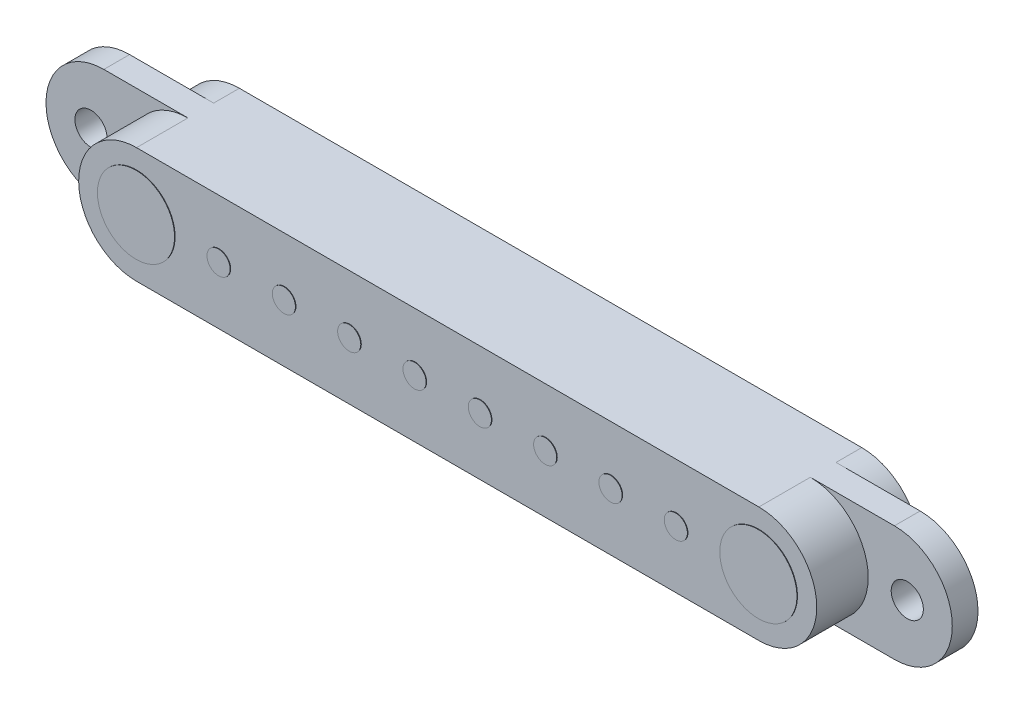
from build123d import *

# Parameters (mm, degrees)
EXTRUDE_1_DEPTH      = 4
EXTRUDE_START        = -2
SKETCH_2_3_R         = 0.625
EXTRUDE_2_DEPTH      = 1
EXTRUDE_3_DEPTH      = 1.5
EXTRUDE_3_DEPTH_BACK = 4.02
SKETCH_4_R           = 0.45
SKETCH_5_R           = 1.5
EXTRUDE_4_DEPTH      = 0.02


with BuildPart() as part:
    # 草图2 → 凸台-拉伸1 (new body)
    with BuildSketch(Plane.XY):
        with BuildLine():
            Line((-12.1, 2.25), (12.1, 2.25))
            ThreePointArc((12.1, 2.25), (14.35, 0), (12.1, -2.25))
            Line((12.1, -2.25), (-12.1, -2.25))
            ThreePointArc((-12.1, -2.25), (-14.35, 0), (-12.1, 2.25))
        make_face()
    extrude(amount=-EXTRUDE_1_DEPTH)

    # 草图2<3> → 凸台-拉伸2 (add)
    with BuildSketch(Plane.XY.offset(EXTRUDE_START)):
        with BuildLine():
            Line((-15.37, 2.25), (15.37, 2.25))
            ThreePointArc((15.37, 2.25), (17.62, 0), (15.37, -2.25))
            Line((15.37, -2.25), (-15.37, -2.25))
            ThreePointArc((-15.37, -2.25), (-17.62, 0), (-15.37, 2.25))
        make_face()
        with Locations((-15.87, 0)):
            Circle(SKETCH_2_3_R, mode=Mode.SUBTRACT)
        with Locations((15.87, 0)):
            Circle(SKETCH_2_3_R, mode=Mode.SUBTRACT)
    extrude(amount=-EXTRUDE_2_DEPTH)

    # 草图4 → 凸台-拉伸3 (add, two sides: drawn at the far end of the back side and taken through both)
    with BuildSketch(Plane(origin=(0, 0, -4), x_dir=(-1, 0, 0), z_dir=(0, 0, -1)).offset(-EXTRUDE_3_DEPTH_BACK)):
        with Locations(Location((-8.89, 0, 0), (0, 0, 180))):
            Circle(SKETCH_4_R)
        with Locations(Location((-6.35, 0, 0), (0, 0, 180))):
            Circle(SKETCH_4_R)
        with Locations(Location((-3.81, 0, 0), (0, 0, 180))):
            Circle(SKETCH_4_R)
        with Locations(Location((-1.27, 0, 0), (0, 0, 180))):
            Circle(SKETCH_4_R)
        with Locations(Location((1.27, 0, 0), (0, 0, 180))):
            Circle(SKETCH_4_R)
        with Locations(Location((3.81, 0, 0), (0, 0, 180))):
            Circle(SKETCH_4_R)
        with Locations(Location((6.35, 0, 0), (0, 0, 180))):
            Circle(SKETCH_4_R)
        with Locations(Location((8.89, 0, 0), (0, 0, 180))):
            Circle(SKETCH_4_R)
    extrude(amount=EXTRUDE_3_DEPTH + EXTRUDE_3_DEPTH_BACK)

    # 草图5 → 凸台-拉伸4 (add)
    with BuildSketch(Plane.XY):
        with Locations(Location((-12.1, 0, 0), (0, 0, 180))):
            Circle(SKETCH_5_R)
        with Locations(Location((12.1, 0, 0), (0, 0, 180))):
            Circle(SKETCH_5_R)
    extrude(amount=EXTRUDE_4_DEPTH)


solid = part.part
